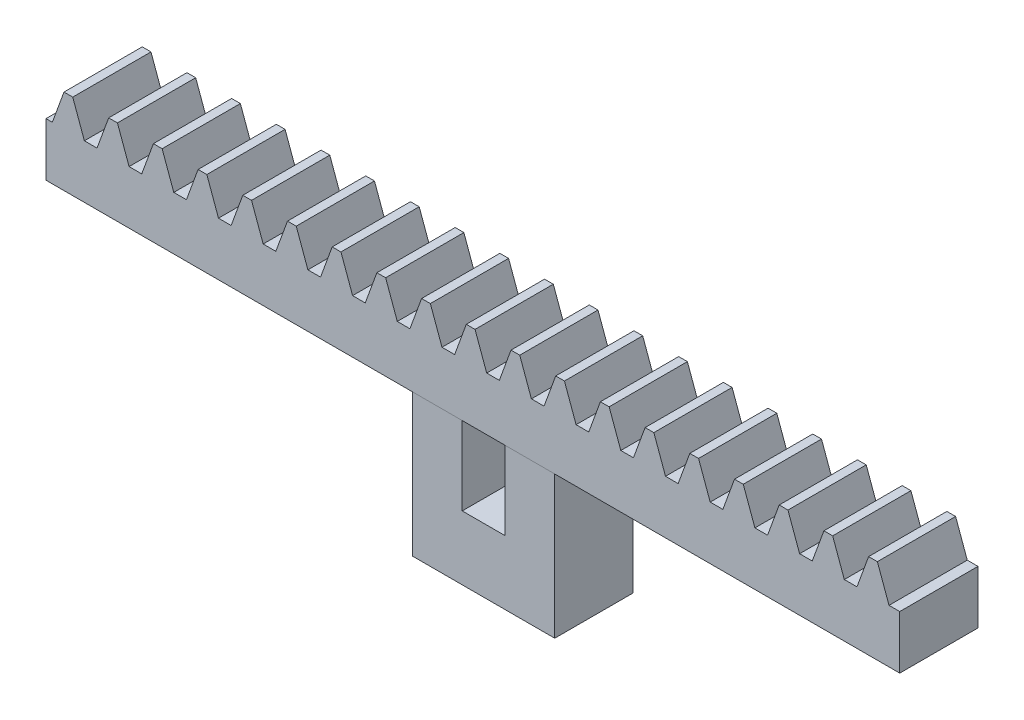
from build123d import *

# Parameters (mm, degrees)
BLANKSKE_W          = 60
BLANKSKE_H          = 6
BLANK_DEPTH         = 5.5
TOOTHCUTSIM_DEPTH   = 61.549566472
TEETHCUTS_COUNT     = 20
TEETHCUTS_PITCH     = 3.14159265
SKETCH_1_W          = 10
SKETCH_1_H          = 10
EXTRUDE_1_DEPTH     = 5.5
SKETCH_2_W          = 3
SKETCH_2_H          = 5.5
CUT_EXTRUDE_1_DEPTH = 62.075772611


with BuildPart() as part:
    # BlankSke → Blank (new body)
    with BuildSketch(Plane.XY):
        with Locations((30, 3)):
            Rectangle(BLANKSKE_W, BLANKSKE_H)
    extrude(amount=-BLANK_DEPTH)

    # TooCutSkeSim → ToothCutSim (cut, through all)
    with BuildSketch(Plane.XY):
        Polygon((0.44443537, 3.75), (-0.44443537, 3.75), (-1.272613241, 6.0254), (1.272613241, 6.0254), align=None)
    toothcutsim = extrude(amount=-TOOTHCUTSIM_DEPTH, mode=Mode.SUBTRACT)

    # TeethCuts: ToothCutSim ×20
    with Locations(*[(i * TEETHCUTS_PITCH, 0, 0) for i in range(1, TEETHCUTS_COUNT)]):
        add(toothcutsim, mode=Mode.SUBTRACT)


with BuildPart() as body_2:
    # ｽｹｯﾁ1 → ﾎﾞｽ - 押し出し1 (new body)
    with BuildSketch(Plane.XY):
        with Locations((30.752516819, -5)):
            Rectangle(SKETCH_1_W, SKETCH_1_H)
    extrude(amount=-EXTRUDE_1_DEPTH)

    # ｽｹｯﾁ2 → ｶｯﾄ - 押し出し1 (cut, through all)
    with BuildSketch(Plane.XY):
        with Locations((30.752516819, -2.75)):
            Rectangle(SKETCH_2_W, SKETCH_2_H)
    extrude(amount=-CUT_EXTRUDE_1_DEPTH, mode=Mode.SUBTRACT)


solid = Compound([part.part, body_2.part])
